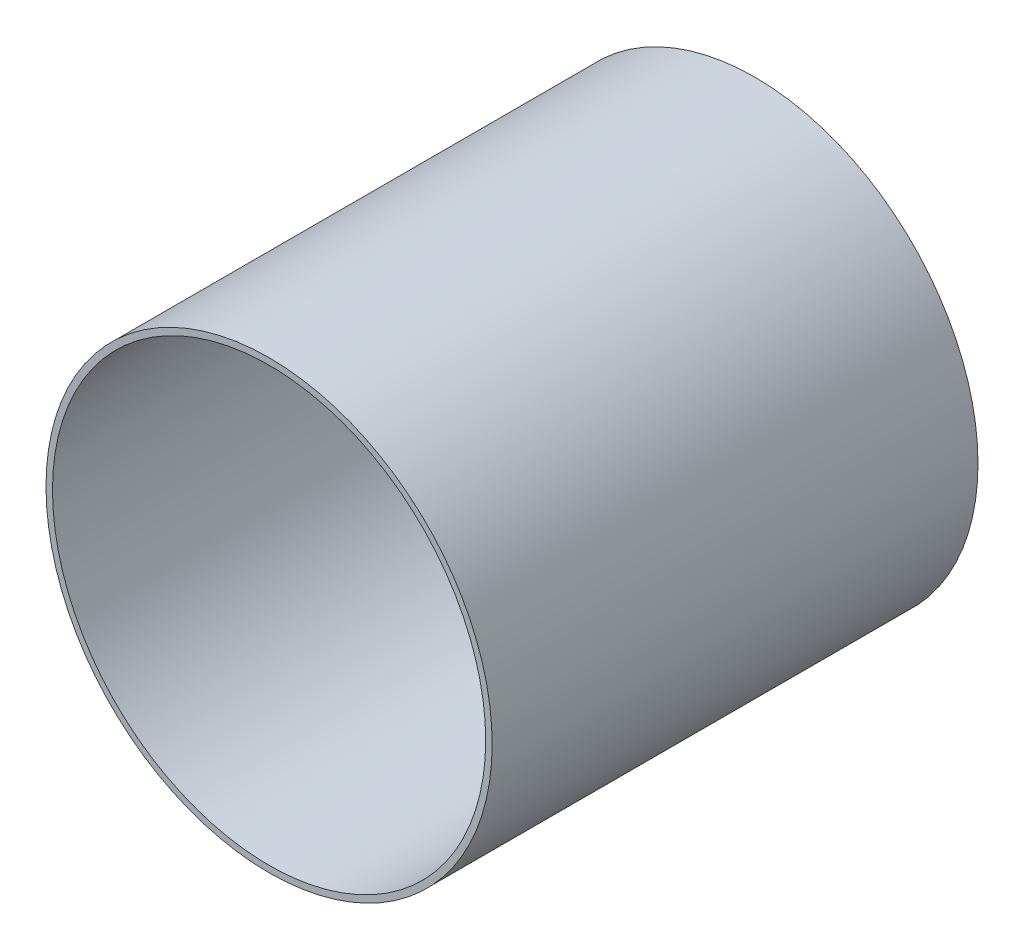
from build123d import *

# Parameters (mm, degrees)
SKIZZE1_R                       = 27.55
SKIZZE1_R_2                     = 26.75
AUFSATZ_LINEAR_AUSTRAGEN1_DEPTH = 60


with BuildPart() as part:
    # Skizze1 → Aufsatz-Linear austragen1 (new body)
    with BuildSketch(Plane.XY):
        Circle(SKIZZE1_R)
        Circle(SKIZZE1_R_2, mode=Mode.SUBTRACT)
    extrude(amount=AUFSATZ_LINEAR_AUSTRAGEN1_DEPTH)


solid = part.part
